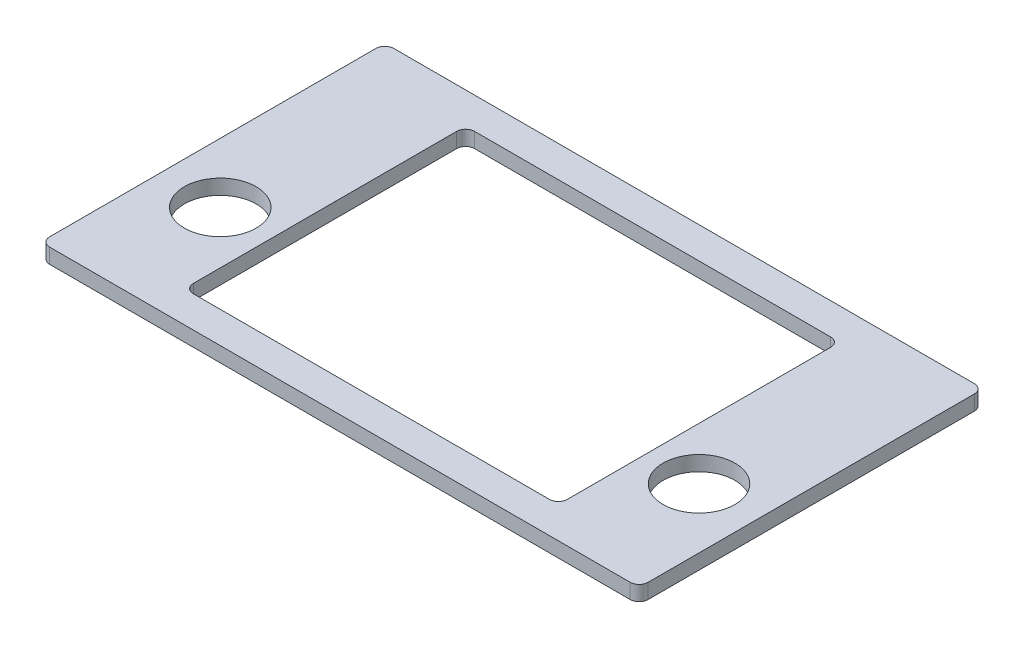
from build123d import *

# Parameters (mm, degrees)
BOSS_EXTRUDE1_DEPTH = 6.35
SKETCH2_R           = 15.24
CUT_EXTRUDE1_DEPTH  = 294.064711284


with BuildPart() as part:
    # Sketch1 → Boss-Extrude1 (new body)
    with BuildSketch(Plane(origin=(0, 0, 0), x_dir=(1, 0, 0), z_dir=(0, 1, 0))):
        with BuildLine():
            Line((3.81, 0), (250.19, 0))
            ThreePointArc((250.19, 0), (252.884076836, 1.115923164), (254, 3.81))
            Line((254, 3.81), (254, 142.24))
            ThreePointArc((254, 142.24), (252.884076836, 144.934076836), (250.19, 146.05))
            Line((250.19, 146.05), (3.81, 146.05))
            ThreePointArc((3.81, 146.05), (1.115923164, 144.934076836), (0, 142.24))
            Line((0, 142.24), (0, 3.81))
            ThreePointArc((0, 3.81), (1.115923164, 1.115923164), (3.81, 0))
        make_face()
        with BuildLine():
            Line((51.435, 132.715), (202.565, 132.715))
            ThreePointArc((202.565, 132.715), (205.259076836, 131.599076836), (206.375, 128.905))
            Line((206.375, 128.905), (206.375, 17.145))
            ThreePointArc((206.375, 17.145), (205.259076836, 14.450923164), (202.565, 13.335))
            Line((202.565, 13.335), (51.435, 13.335))
            ThreePointArc((51.435, 13.335), (48.740923164, 14.450923164), (47.625, 17.145))
            Line((47.625, 17.145), (47.625, 128.905))
            ThreePointArc((47.625, 128.905), (48.740923164, 131.599076836), (51.435, 132.715))
        make_face(mode=Mode.SUBTRACT)
    extrude(amount=BOSS_EXTRUDE1_DEPTH)

    # Sketch2 → Cut-Extrude1 (cut, through all)
    with BuildSketch(Plane(origin=(0, 6.35, 0), x_dir=(1, 0, 0), z_dir=(0, 1, 0))):
        with Locations(Location((25.4, 50.8, 0), (0, 0, 270))):
            Circle(SKETCH2_R)
        with Locations(Location((228.6, 50.8, 0), (0, 0, 270))):
            Circle(SKETCH2_R)
    extrude(amount=-CUT_EXTRUDE1_DEPTH, mode=Mode.SUBTRACT)


solid = part.part
